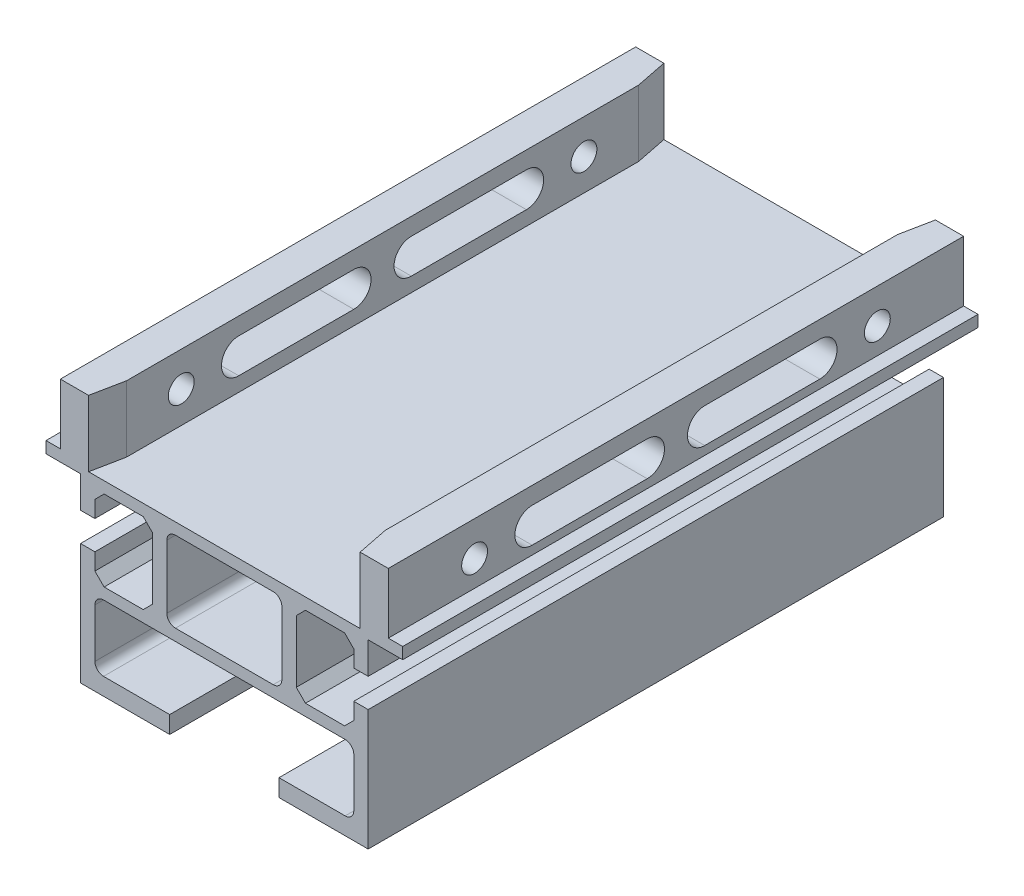
from build123d import *
from OCP.BRepFilletAPI import BRepFilletAPI_MakeChamfer

# Parameters (mm, degrees)
SCHIZZO1_W                   = 20
SCHIZZO1_H                   = 14
ESTRUSIONE_ESTRUSIONE1_DEPTH = 100
SMUSSO1_SIZE                 = 1.6
RACCORDO1_R                  = 1.5
SMUSSO2_SIZE                 = 5.5
SMUSSO2_SIZE2                = 1.1
SMUSSO3_SIZE                 = 5.5
SMUSSO3_SIZE2                = 1.1
FORO_PER_VITE_M4_1_D         = 4.5
FORO_PER_VITE_M4_1_DEPTH     = 188
FORO_PER_VITE_M4_1_TIP       = 1.351936393
TAGLIO_ESTRUSIONE1_DEPTH     = 81


with BuildPart() as part:
    # Schizzo1 → Estrusione-Estrusione1 (new body)
    with BuildSketch(Plane.XY):
        Polygon((0, 0), (15.5, 0), (15.5, 21), (13, 21), (13, 16.5), (3, 16.5), (3, 30.5), (13, 30.5), (13, 26), (15.5, 26), (15.5, 31.5), (21.5, 31.5), (21.5, 33.5), (19, 33.5), (19, 44), (13, 44), (13, 32.5), (-32, 32.5), (-32, 44), (-38, 44), (-38, 33.5), (-40.5, 33.5), (-40.5, 31.5), (-34.5, 31.5), (-34.5, 26), (-32, 26), (-32, 30.5), (-22, 30.5), (-22, 16.5), (-32, 16.5), (-32, 21), (-34.5, 21), (-34.5, 0), (-19, 0), (-19, 3), (-32, 3), (-32, 14.5), (13, 14.5), (13, 3), (0, 3), align=None)
        with Locations((-9.5, 23.5)):
            Rectangle(SCHIZZO1_W, SCHIZZO1_H, mode=Mode.SUBTRACT)
    extrude(amount=ESTRUSIONE_ESTRUSIONE1_DEPTH)

    # Smusso1
    smusso1_edges = [part.edges().sort_by_distance(p)[0] for p in [
        (-32, 16.5, 50),
        (-22, 16.5, 50),
        (-22, 30.5, 50),
        (-32, 30.5, 50),
        (13, 30.5, 50),
        (3, 30.5, 50),
        (3, 16.5, 50),
        (13, 16.5, 50),
    ]]
    chamfer(smusso1_edges, length=SMUSSO1_SIZE)

    # Raccordo1
    raccordo1_edges = [part.edges().sort_by_distance(p)[0] for p in [
        (13, 3, 50),
        (13, 14.5, 50),
        (-32, 14.5, 50),
        (-32, 3, 50),
        (-19.5, 30.5, 50),
        (-19.5, 16.5, 50),
        (0.5, 16.5, 50),
        (0.5, 30.5, 50),
    ]]
    fillet(raccordo1_edges, radius=RACCORDO1_R)

    # Smusso2: one chamfer whose edges measure the first distance from different faces: ONE call of the kernel's chamfer builder (chamfer() names one face for all edges)
    smusso2_edges_1 = [part.edges().sort_by_distance(p)[0] for p in [
        (13, 38.25, 100),
    ]]
    smusso2_side_1 = [part.faces().sort_by_distance(p)[0] for p in [
        (13, 38.25, 50),
    ]]
    smusso2_edges_2 = [part.edges().sort_by_distance(p)[0] for p in [
        (-32, 38.25, 100),
    ]]
    smusso2_side_2 = [part.faces().sort_by_distance(p)[0] for p in [
        (-32, 38.25, 50),
    ]]
    smusso2 = BRepFilletAPI_MakeChamfer(part.part.solid().wrapped)
    for e in smusso2_edges_1:
        smusso2.Add(SMUSSO2_SIZE, SMUSSO2_SIZE2, e.wrapped, smusso2_side_1[0].wrapped)  # the first distance lies on this face
    for e in smusso2_edges_2:
        smusso2.Add(SMUSSO2_SIZE, SMUSSO2_SIZE2, e.wrapped, smusso2_side_2[0].wrapped)  # the first distance lies on this face
    add(Compound.cast(smusso2.Shape()), mode=Mode.REPLACE)

    # Smusso3: one chamfer whose edges measure the first distance from different faces: ONE call of the kernel's chamfer builder (chamfer() names one face for all edges)
    smusso3_edges_1 = [part.edges().sort_by_distance(p)[0] for p in [
        (-32, 38.25, 0),
    ]]
    smusso3_side_1 = [part.faces().sort_by_distance(p)[0] for p in [
        (-32, 38.25, 47.25),
    ]]
    smusso3_edges_2 = [part.edges().sort_by_distance(p)[0] for p in [
        (13, 38.25, 0),
    ]]
    smusso3_side_2 = [part.faces().sort_by_distance(p)[0] for p in [
        (13, 38.25, 47.25),
    ]]
    smusso3 = BRepFilletAPI_MakeChamfer(part.part.solid().wrapped)
    for e in smusso3_edges_1:
        smusso3.Add(SMUSSO3_SIZE, SMUSSO3_SIZE2, e.wrapped, smusso3_side_1[0].wrapped)  # the first distance lies on this face
    for e in smusso3_edges_2:
        smusso3.Add(SMUSSO3_SIZE, SMUSSO3_SIZE2, e.wrapped, smusso3_side_2[0].wrapped)  # the first distance lies on this face
    add(Compound.cast(smusso3.Shape()), mode=Mode.REPLACE)

    # Foro per Vite M4-1
    with Locations(Plane(origin=(19, 0, 0), x_dir=(0, 0, -1), z_dir=(1, 0, 0))):
        with Locations((-85, 38), (-15, 38)):
            Hole(FORO_PER_VITE_M4_1_D / 2, depth=FORO_PER_VITE_M4_1_DEPTH)
            with Locations((0, 0, -(FORO_PER_VITE_M4_1_DEPTH + FORO_PER_VITE_M4_1_TIP / 2))):  # 118° drill point
                Cone(0, FORO_PER_VITE_M4_1_D / 2, FORO_PER_VITE_M4_1_TIP, mode=Mode.SUBTRACT)

    # Schizzo4 → Taglio-Estrusione1 (cut)
    with BuildSketch(Plane(origin=(19, 0, 0), x_dir=(0, 0, -1), z_dir=(1, 0, 0))):
        with BuildLine():
            Line((-75, 41), (-55, 41))
            ThreePointArc((-55, 41), (-52, 38), (-55, 35))
            Line((-55, 35), (-75, 35))
            ThreePointArc((-75, 35), (-78, 38), (-75, 41))
        make_face()
        with BuildLine():
            Line((-45, 41), (-25, 41))
            ThreePointArc((-25, 41), (-22, 38), (-25, 35))
            Line((-25, 35), (-45, 35))
            ThreePointArc((-45, 35), (-48, 38), (-45, 41))
        make_face()
    extrude(amount=-TAGLIO_ESTRUSIONE1_DEPTH, mode=Mode.SUBTRACT)


solid = part.part
